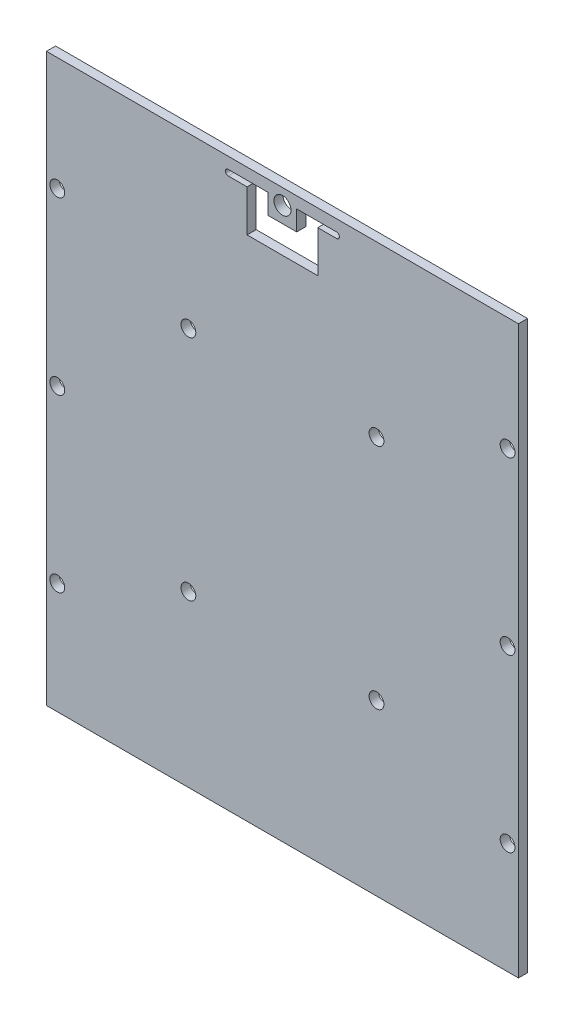
from build123d import *

# Parameters (mm, degrees)
SKETCH1_W               = 82.8
SKETCH1_H               = 213.8
SKETCH1_R               = 0.8
PCB_EXTRUDE_DEPTH       = 1.6
SKETCH3_R               = 1.5
SOLAR_HOLE_DEPTH        = 1.6
CUT_EXTRUDE1_DEPTH      = 115.647852139
CUT_EXTRUDE1_DEPTH_BACK = 115.647852139
SKETCH8_W               = 82.8
SKETCH8_H               = 114.4
M2_CLEARANCE_HOLE1_D    = 2.6


with BuildPart() as part:
    # Sketch1 → pcb extrude (new body)
    with BuildSketch(Plane.XY):
        Rectangle(SKETCH1_W, SKETCH1_H)
        with Locations((-39.5, -27)):
            Circle(SKETCH1_R, mode=Mode.SUBTRACT)
        with Locations((39.5, -27)):
            Circle(SKETCH1_R, mode=Mode.SUBTRACT)
        with Locations((-39.5, 87)):
            Circle(SKETCH1_R, mode=Mode.SUBTRACT)
        with Locations((-39.5, 57)):
            Circle(SKETCH1_R, mode=Mode.SUBTRACT)
        with Locations((-39.5, 27)):
            Circle(SKETCH1_R, mode=Mode.SUBTRACT)
        with Locations((-39.5, -57)):
            Circle(SKETCH1_R, mode=Mode.SUBTRACT)
        with Locations((-39.5, -87)):
            Circle(SKETCH1_R, mode=Mode.SUBTRACT)
        with Locations((0, -104.2)):
            Circle(SKETCH1_R, mode=Mode.SUBTRACT)
        with Locations((39.5, -87)):
            Circle(SKETCH1_R, mode=Mode.SUBTRACT)
        with Locations((39.5, -57)):
            Circle(SKETCH1_R, mode=Mode.SUBTRACT)
        with Locations((39.5, 27)):
            Circle(SKETCH1_R, mode=Mode.SUBTRACT)
        with Locations((39.5, 57)):
            Circle(SKETCH1_R, mode=Mode.SUBTRACT)
        with Locations((39.5, 87)):
            Circle(SKETCH1_R, mode=Mode.SUBTRACT)
        with Locations((0, 104.2)):
            Circle(SKETCH1_R, mode=Mode.SUBTRACT)
    extrude(amount=PCB_EXTRUDE_DEPTH)

    # Sketch3 → Solar Hole (cut)
    with BuildSketch(Plane.XY.offset(1.6)):
        with Locations((0, 104.2)):
            Circle(SKETCH3_R)
        with BuildLine():
            Line((-2.5, 101.4), (2.5, 101.4))
            Line((2.5, 101.4), (2.5, 104.9))
            Line((2.5, 104.9), (9.5, 104.9))
            ThreePointArc((9.5, 104.9), (10, 104.4), (9.5, 103.9))
            Line((9.5, 103.9), (6.2, 103.9))
            Line((6.2, 103.9), (6.2, 101.4))
            Line((6.2, 101.4), (6.2, 96.6))
            Line((6.2, 96.6), (-6.2, 96.6))
            Line((-6.2, 96.6), (-6.2, 101.4))
            Line((-6.2, 101.4), (-6.2, 103.9))
            Line((-6.2, 103.9), (-9.5, 103.9))
            ThreePointArc((-9.5, 103.9), (-10, 104.4), (-9.5, 104.9))
            Line((-9.5, 104.9), (-2.5, 104.9))
            Line((-2.5, 104.9), (-2.5, 101.4))
        make_face()
    extrude(amount=-SOLAR_HOLE_DEPTH, mode=Mode.SUBTRACT)

    # Sketch8 → Cut-Extrude1 (cut, two sides: drawn at the far end of the back side and taken through both)
    with BuildSketch(Plane.XY.offset(1.6).offset(-CUT_EXTRUDE1_DEPTH_BACK)):
        with Locations((0, -49.7)):
            Rectangle(SKETCH8_W, SKETCH8_H)
    extrude(amount=CUT_EXTRUDE1_DEPTH + CUT_EXTRUDE1_DEPTH_BACK, mode=Mode.SUBTRACT)

    # M2 Clearance Hole1 (through all)
    with Locations(Plane(origin=(0, 0, 0), x_dir=(-1, 0, 0), z_dir=(0, 0, -1))):
        with Locations((39.5, 87), (-39.5, 87), (39.5, 57), (-39.5, 57), (39.5, 27), (-39.5, 27), (16.5, 77.25), (-16.5, 77.25), (-16.5, 37.25), (16.5, 37.25)):
            Hole(M2_CLEARANCE_HOLE1_D / 2)


solid = part.part
